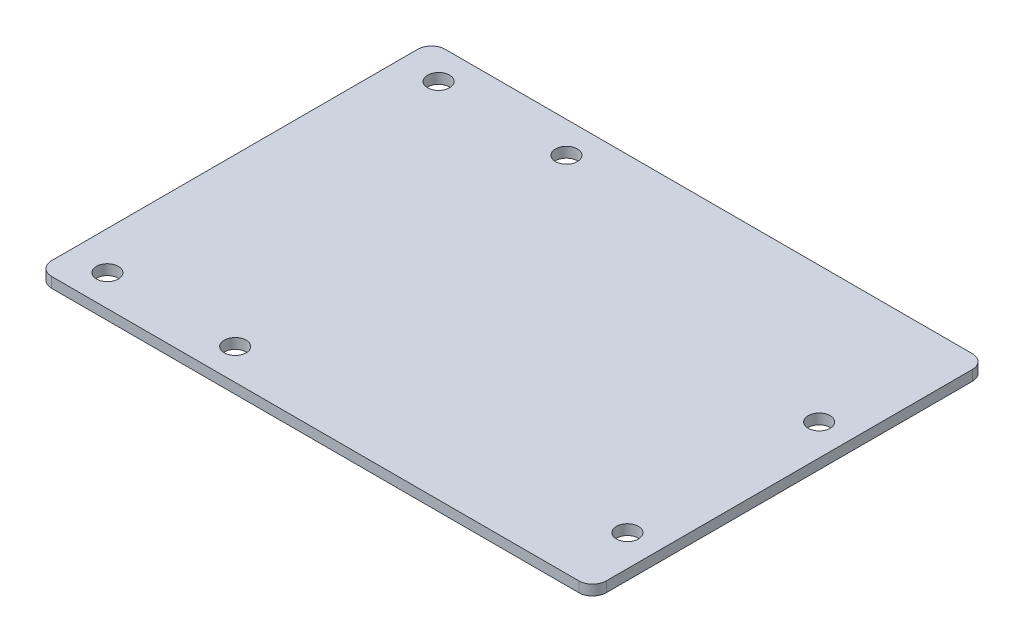
from build123d import *

# Parameters (mm, degrees)
SKETCH_2_W      = 80.819107854
SKETCH_2_H      = 57.34
SKETCH_2_R      = 1.6
EXTRUDE_1_DEPTH = 1.5
FILLET_1_R      = 2


with BuildPart() as part:
    # 스케치2 → 보스-돌출1 (new body)
    with BuildSketch(Plane(origin=(0, 0, 0), x_dir=(1, 0, 0), z_dir=(0, 1, 0))):
        with Locations((-2.909553927, 0)):
            Rectangle(SKETCH_2_W, SKETCH_2_H)
        with Locations(Location((-37.73627176, 24.13, 0), (0, 0, 270))):
            Circle(SKETCH_2_R, mode=Mode.SUBTRACT)
        with Locations(Location((-37.73627176, -24.13, 0), (0, 0, 90))):
            Circle(SKETCH_2_R, mode=Mode.SUBTRACT)
        with BuildLine():
            ThreePointArc((31.36, 8.89), (32.96, 7.29), (34.56, 8.89))
            ThreePointArc((34.56, 8.89), (32.96, 10.49), (31.36, 8.89))
        make_face(mode=Mode.SUBTRACT)
        with BuildLine():
            ThreePointArc((31.36, -19.05), (32.96, -20.65), (34.56, -19.05))
            ThreePointArc((34.56, -19.05), (32.96, -17.45), (31.36, -19.05))
        make_face(mode=Mode.SUBTRACT)
        with BuildLine():
            ThreePointArc((-20.71, -24.13), (-19.11, -25.73), (-17.51, -24.13))
            ThreePointArc((-17.51, -24.13), (-19.11, -22.53), (-20.71, -24.13))
        make_face(mode=Mode.SUBTRACT)
        with BuildLine():
            ThreePointArc((-20.71, 24.13), (-19.11, 25.73), (-17.51, 24.13))
            ThreePointArc((-17.51, 24.13), (-19.11, 22.53), (-20.71, 24.13))
        make_face(mode=Mode.SUBTRACT)
    extrude(amount=EXTRUDE_1_DEPTH)

    # 필렛1
    fillet_1_edges = [part.edges().sort_by_distance(p)[0] for p in [
        (37.5, 0.75, 28.67),
        (-43.319107854, 0.75, 28.67),
        (-43.319107854, 0.75, -28.67),
        (37.5, 0.75, -28.67),
    ]]
    fillet(fillet_1_edges, radius=FILLET_1_R)


solid = part.part
